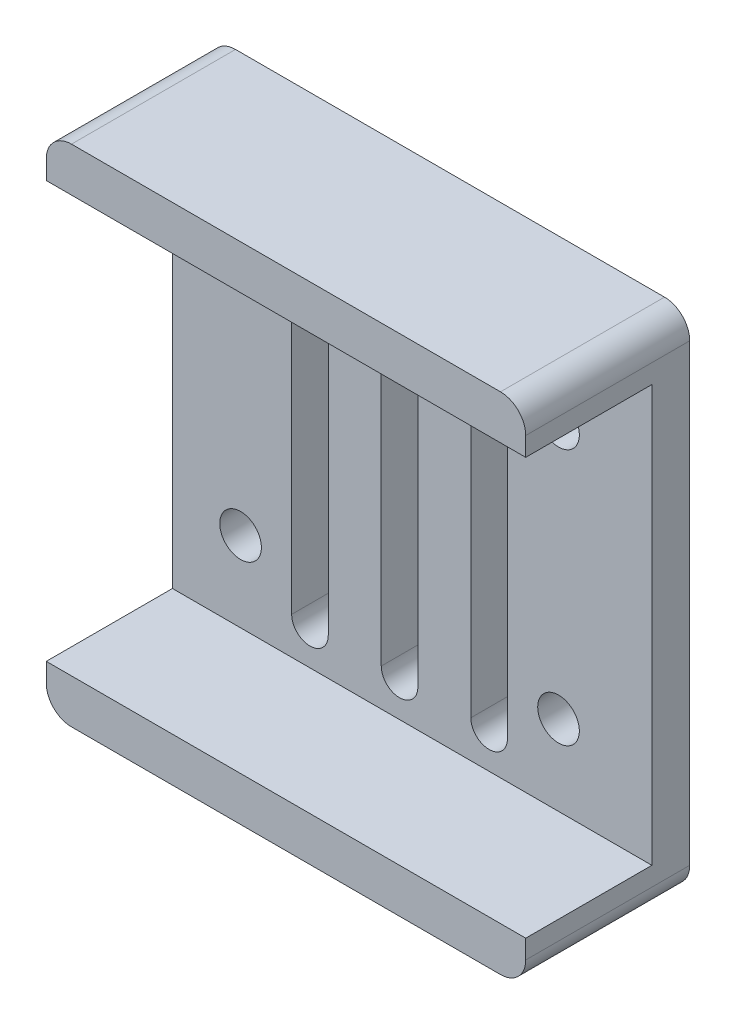
from build123d import *

# Parameters (mm, degrees)
SKETCH1_R           = 1.65
BOSS_EXTRUDE1_DEPTH = 13
CUT_EXTRUDE1_DEPTH  = 32.128764833
SKETCH3_W           = 52.718311268
SKETCH3_H           = 33
CUT_EXTRUDE2_DEPTH  = 10


with BuildPart() as part:
    # Sketch1 → Boss-Extrude1 (new body)
    with BuildSketch(Plane.XY):
        with BuildLine():
            Line((0, 20), (-16, 20))
            ThreePointArc((-16, 20), (-17.414213562, 19.414213562), (-18, 18))
            Line((-18, 18), (-18, -18))
            ThreePointArc((-18, -18), (-17.414213562, -19.414213562), (-16, -20))
            Line((-16, -20), (0, -20))
            Line((0, -20), (18, -20))
            ThreePointArc((18, -20), (19.414213562, -19.414213562), (20, -18))
            Line((20, -18), (20, 18))
            ThreePointArc((20, 18), (19.414213562, 19.414213562), (18, 20))
            Line((18, 20), (0, 20))
        make_face()
        with Locations(Location((-12.6, 10.16, 0), (0, 0, 180))):
            Circle(SKETCH1_R, mode=Mode.SUBTRACT)
        with Locations(Location((12.6, 10.16, 0), (0, 0, 180))):
            Circle(SKETCH1_R, mode=Mode.SUBTRACT)
        with Locations(Location((12.6, -10.16, 0), (0, 0, 180))):
            Circle(SKETCH1_R, mode=Mode.SUBTRACT)
        with Locations(Location((-12.6, -10.16, 0), (0, 0, 180))):
            Circle(SKETCH1_R, mode=Mode.SUBTRACT)
    extrude(amount=BOSS_EXTRUDE1_DEPTH)

    # Sketch2 → Cut-Extrude1 (cut, through all)
    with BuildSketch(Plane.XY.offset(13)):
        with BuildLine():
            Line((5.65, -13.55), (5.65, 13.55))
            ThreePointArc((5.65, 13.55), (7.1, 15), (8.55, 13.55))
            Line((8.55, 13.55), (8.55, -13.55))
            ThreePointArc((8.55, -13.55), (7.1, -15), (5.65, -13.55))
        make_face()
        with BuildLine():
            Line((1.45, -13.55), (1.45, 13.55))
            ThreePointArc((1.45, 13.55), (0, 15), (-1.45, 13.55))
            Line((-1.45, 13.55), (-1.45, -13.55))
            ThreePointArc((-1.45, -13.55), (0, -15), (1.45, -13.55))
        make_face()
        with BuildLine():
            Line((-8.55, -13.55), (-8.55, 13.55))
            ThreePointArc((-8.55, 13.55), (-7.1, 15), (-5.65, 13.55))
            Line((-5.65, 13.55), (-5.65, -13.55))
            ThreePointArc((-5.65, -13.55), (-7.1, -15), (-8.55, -13.55))
        make_face()
    extrude(amount=-CUT_EXTRUDE1_DEPTH, mode=Mode.SUBTRACT)

    # Sketch3 → Cut-Extrude2 (cut)
    with BuildSketch(Plane.XY.offset(13)):
        Rectangle(SKETCH3_W, SKETCH3_H)
    extrude(amount=-CUT_EXTRUDE2_DEPTH, mode=Mode.SUBTRACT)


solid = part.part
